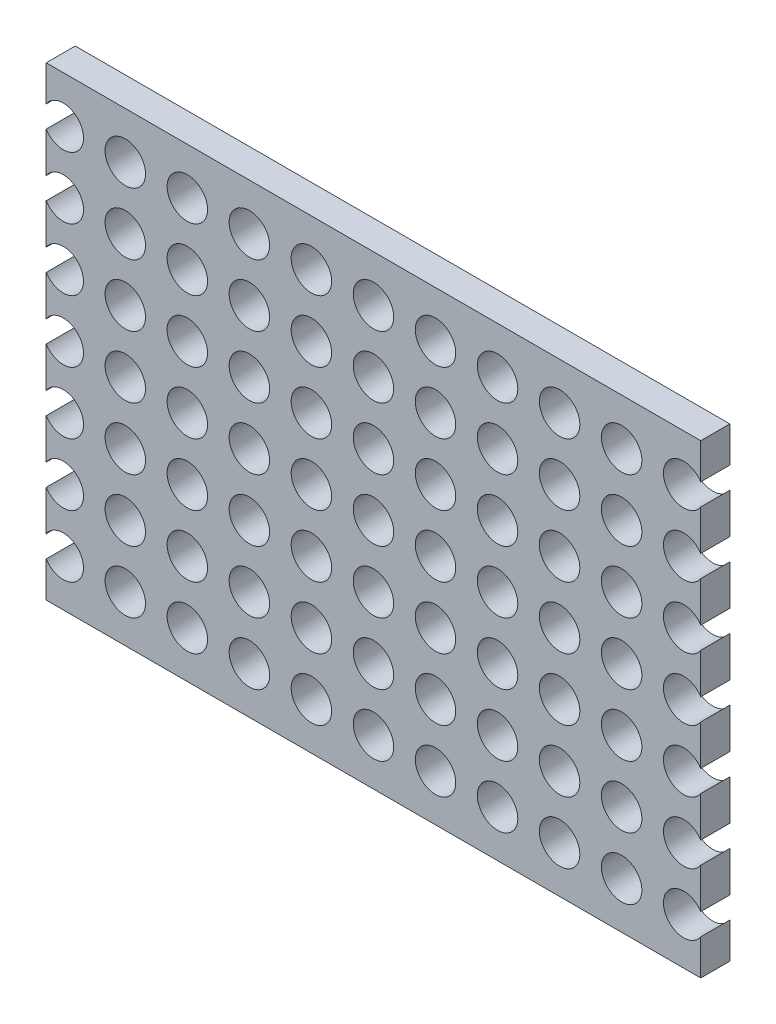
from build123d import *

# Parameters (mm, degrees)
SKETCH1_W           = 107.188
SKETCH1_H           = 76.2
EXTRUDE1_DEPTH      = 4.7625
LPATTERN1_COUNT     = 6
LPATTERN1_PITCH     = 10.16
LPATTERN1_COL_COUNT = 6
LPATTERN1_COL_PITCH = 10.16
LPATTERN2_COUNT     = 4
LPATTERN2_PITCH     = 10.16
LPATTERN2_COL_COUNT = 4
LPATTERN2_COL_PITCH = 10.16


with BuildPart() as part:
    # Sketch1 → Extrude1 (new body)
    with BuildSketch(Plane.XY):
        Rectangle(SKETCH1_W, SKETCH1_H)
    extrude(amount=EXTRUDE1_DEPTH)

    # Sketch5 → G (0.261) Diameter Hole1 (revolve, cut)
    with BuildSketch(Plane(origin=(0, 0, 4.7625), x_dir=(0, -1, 0), z_dir=(1, 0, 0))):
        Polygon((0, 0), (0, 17.231672694), (3.3147, 15.24), (3.3147, 0), align=None)
    g_0_261_diameter_hole1 = revolve(axis=Axis((0, 0, 11.1125), (0, 0, -1)), mode=Mode.SUBTRACT)

    # LPattern1: G (0.261) Diameter Hole1 ×6
    with Locations(*[(i * LPATTERN1_PITCH, 0, 0) for i in range(1, LPATTERN1_COUNT)]):
        add(g_0_261_diameter_hole1, mode=Mode.SUBTRACT)

    # LPattern1 col: G (0.261) Diameter Hole1 ×6
    with Locations(*[(-i * LPATTERN1_COL_PITCH, 0, 0) for i in range(1, LPATTERN1_COL_COUNT)]):
        add(g_0_261_diameter_hole1, mode=Mode.SUBTRACT)

    # LPattern2: G (0.261) Diameter Hole1 ×4
    with Locations(*[(0, -i * LPATTERN2_PITCH, 0) for i in range(1, LPATTERN2_COUNT)]):
        add(g_0_261_diameter_hole1, mode=Mode.SUBTRACT)

    # LPattern2 copy 1 sketch → LPattern2 copy 1 (revolve, cut)
    with BuildSketch(Plane(origin=(10.16, -10.16, 4.7625), x_dir=(0, -1, 0), z_dir=(1, 0, 0))):
        Polygon((0, 0), (0, 17.231672694), (3.3147, 15.24), (3.3147, 0), align=None)
    revolve(axis=Axis((10.16, -10.16, 11.1125), (0, 0, -1)), mode=Mode.SUBTRACT)

    # LPattern2 copy 2 sketch → LPattern2 copy 2 (revolve, cut)
    with BuildSketch(Plane(origin=(10.16, -20.32, 4.7625), x_dir=(0, -1, 0), z_dir=(1, 0, 0))):
        Polygon((0, 0), (0, 17.231672694), (3.3147, 15.24), (3.3147, 0), align=None)
    revolve(axis=Axis((10.16, -20.32, 11.1125), (0, 0, -1)), mode=Mode.SUBTRACT)

    # LPattern2 copy 3 sketch → LPattern2 copy 3 (revolve, cut)
    with BuildSketch(Plane(origin=(10.16, -30.48, 4.7625), x_dir=(0, -1, 0), z_dir=(1, 0, 0))):
        Polygon((0, 0), (0, 17.231672694), (3.3147, 15.24), (3.3147, 0), align=None)
    revolve(axis=Axis((10.16, -30.48, 11.1125), (0, 0, -1)), mode=Mode.SUBTRACT)

    # LPattern2 copy 4 sketch → LPattern2 copy 4 (revolve, cut)
    with BuildSketch(Plane(origin=(20.32, -10.16, 4.7625), x_dir=(0, -1, 0), z_dir=(1, 0, 0))):
        Polygon((0, 0), (0, 17.231672694), (3.3147, 15.24), (3.3147, 0), align=None)
    revolve(axis=Axis((20.32, -10.16, 11.1125), (0, 0, -1)), mode=Mode.SUBTRACT)

    # LPattern2 copy 5 sketch → LPattern2 copy 5 (revolve, cut)
    with BuildSketch(Plane(origin=(20.32, -20.32, 4.7625), x_dir=(0, -1, 0), z_dir=(1, 0, 0))):
        Polygon((0, 0), (0, 17.231672694), (3.3147, 15.24), (3.3147, 0), align=None)
    revolve(axis=Axis((20.32, -20.32, 11.1125), (0, 0, -1)), mode=Mode.SUBTRACT)

    # LPattern2 copy 6 sketch → LPattern2 copy 6 (revolve, cut)
    with BuildSketch(Plane(origin=(20.32, -30.48, 4.7625), x_dir=(0, -1, 0), z_dir=(1, 0, 0))):
        Polygon((0, 0), (0, 17.231672694), (3.3147, 15.24), (3.3147, 0), align=None)
    revolve(axis=Axis((20.32, -30.48, 11.1125), (0, 0, -1)), mode=Mode.SUBTRACT)

    # LPattern2 copy 7 sketch → LPattern2 copy 7 (revolve, cut)
    with BuildSketch(Plane(origin=(30.48, -10.16, 4.7625), x_dir=(0, -1, 0), z_dir=(1, 0, 0))):
        Polygon((0, 0), (0, 17.231672694), (3.3147, 15.24), (3.3147, 0), align=None)
    revolve(axis=Axis((30.48, -10.16, 11.1125), (0, 0, -1)), mode=Mode.SUBTRACT)

    # LPattern2 copy 8 sketch → LPattern2 copy 8 (revolve, cut)
    with BuildSketch(Plane(origin=(30.48, -20.32, 4.7625), x_dir=(0, -1, 0), z_dir=(1, 0, 0))):
        Polygon((0, 0), (0, 17.231672694), (3.3147, 15.24), (3.3147, 0), align=None)
    revolve(axis=Axis((30.48, -20.32, 11.1125), (0, 0, -1)), mode=Mode.SUBTRACT)

    # LPattern2 copy 9 sketch → LPattern2 copy 9 (revolve, cut)
    with BuildSketch(Plane(origin=(30.48, -30.48, 4.7625), x_dir=(0, -1, 0), z_dir=(1, 0, 0))):
        Polygon((0, 0), (0, 17.231672694), (3.3147, 15.24), (3.3147, 0), align=None)
    revolve(axis=Axis((30.48, -30.48, 11.1125), (0, 0, -1)), mode=Mode.SUBTRACT)

    # LPattern2 copy 10 sketch → LPattern2 copy 10 (revolve, cut)
    with BuildSketch(Plane(origin=(40.64, -10.16, 4.7625), x_dir=(0, -1, 0), z_dir=(1, 0, 0))):
        Polygon((0, 0), (0, 17.231672694), (3.3147, 15.24), (3.3147, 0), align=None)
    revolve(axis=Axis((40.64, -10.16, 11.1125), (0, 0, -1)), mode=Mode.SUBTRACT)

    # LPattern2 copy 11 sketch → LPattern2 copy 11 (revolve, cut)
    with BuildSketch(Plane(origin=(40.64, -20.32, 4.7625), x_dir=(0, -1, 0), z_dir=(1, 0, 0))):
        Polygon((0, 0), (0, 17.231672694), (3.3147, 15.24), (3.3147, 0), align=None)
    revolve(axis=Axis((40.64, -20.32, 11.1125), (0, 0, -1)), mode=Mode.SUBTRACT)

    # LPattern2 copy 12 sketch → LPattern2 copy 12 (revolve, cut)
    with BuildSketch(Plane(origin=(40.64, -30.48, 4.7625), x_dir=(0, -1, 0), z_dir=(1, 0, 0))):
        Polygon((0, 0), (0, 17.231672694), (3.3147, 15.24), (3.3147, 0), align=None)
    revolve(axis=Axis((40.64, -30.48, 11.1125), (0, 0, -1)), mode=Mode.SUBTRACT)

    # LPattern2 copy 13 sketch → LPattern2 copy 13 (revolve, cut)
    with BuildSketch(Plane(origin=(50.8, -10.16, 4.7625), x_dir=(0, -1, 0), z_dir=(1, 0, 0))):
        Polygon((0, 0), (0, 17.231672694), (3.3147, 15.24), (3.3147, 0), align=None)
    revolve(axis=Axis((50.8, -10.16, 11.1125), (0, 0, -1)), mode=Mode.SUBTRACT)

    # LPattern2 copy 14 sketch → LPattern2 copy 14 (revolve, cut)
    with BuildSketch(Plane(origin=(50.8, -20.32, 4.7625), x_dir=(0, -1, 0), z_dir=(1, 0, 0))):
        Polygon((0, 0), (0, 17.231672694), (3.3147, 15.24), (3.3147, 0), align=None)
    revolve(axis=Axis((50.8, -20.32, 11.1125), (0, 0, -1)), mode=Mode.SUBTRACT)

    # LPattern2 copy 15 sketch → LPattern2 copy 15 (revolve, cut)
    with BuildSketch(Plane(origin=(50.8, -30.48, 4.7625), x_dir=(0, -1, 0), z_dir=(1, 0, 0))):
        Polygon((0, 0), (0, 17.231672694), (3.3147, 15.24), (3.3147, 0), align=None)
    revolve(axis=Axis((50.8, -30.48, 11.1125), (0, 0, -1)), mode=Mode.SUBTRACT)

    # LPattern2 copy 16 sketch → LPattern2 copy 16 (revolve, cut)
    with BuildSketch(Plane(origin=(-10.16, -10.16, 4.7625), x_dir=(0, -1, 0), z_dir=(1, 0, 0))):
        Polygon((0, 0), (0, 17.231672694), (3.3147, 15.24), (3.3147, 0), align=None)
    revolve(axis=Axis((-10.16, -10.16, 11.1125), (0, 0, -1)), mode=Mode.SUBTRACT)

    # LPattern2 copy 17 sketch → LPattern2 copy 17 (revolve, cut)
    with BuildSketch(Plane(origin=(-10.16, -20.32, 4.7625), x_dir=(0, -1, 0), z_dir=(1, 0, 0))):
        Polygon((0, 0), (0, 17.231672694), (3.3147, 15.24), (3.3147, 0), align=None)
    revolve(axis=Axis((-10.16, -20.32, 11.1125), (0, 0, -1)), mode=Mode.SUBTRACT)

    # LPattern2 copy 18 sketch → LPattern2 copy 18 (revolve, cut)
    with BuildSketch(Plane(origin=(-10.16, -30.48, 4.7625), x_dir=(0, -1, 0), z_dir=(1, 0, 0))):
        Polygon((0, 0), (0, 17.231672694), (3.3147, 15.24), (3.3147, 0), align=None)
    revolve(axis=Axis((-10.16, -30.48, 11.1125), (0, 0, -1)), mode=Mode.SUBTRACT)

    # LPattern2 copy 19 sketch → LPattern2 copy 19 (revolve, cut)
    with BuildSketch(Plane(origin=(-20.32, -10.16, 4.7625), x_dir=(0, -1, 0), z_dir=(1, 0, 0))):
        Polygon((0, 0), (0, 17.231672694), (3.3147, 15.24), (3.3147, 0), align=None)
    revolve(axis=Axis((-20.32, -10.16, 11.1125), (0, 0, -1)), mode=Mode.SUBTRACT)

    # LPattern2 copy 20 sketch → LPattern2 copy 20 (revolve, cut)
    with BuildSketch(Plane(origin=(-20.32, -20.32, 4.7625), x_dir=(0, -1, 0), z_dir=(1, 0, 0))):
        Polygon((0, 0), (0, 17.231672694), (3.3147, 15.24), (3.3147, 0), align=None)
    revolve(axis=Axis((-20.32, -20.32, 11.1125), (0, 0, -1)), mode=Mode.SUBTRACT)

    # LPattern2 copy 21 sketch → LPattern2 copy 21 (revolve, cut)
    with BuildSketch(Plane(origin=(-20.32, -30.48, 4.7625), x_dir=(0, -1, 0), z_dir=(1, 0, 0))):
        Polygon((0, 0), (0, 17.231672694), (3.3147, 15.24), (3.3147, 0), align=None)
    revolve(axis=Axis((-20.32, -30.48, 11.1125), (0, 0, -1)), mode=Mode.SUBTRACT)

    # LPattern2 copy 22 sketch → LPattern2 copy 22 (revolve, cut)
    with BuildSketch(Plane(origin=(-30.48, -10.16, 4.7625), x_dir=(0, -1, 0), z_dir=(1, 0, 0))):
        Polygon((0, 0), (0, 17.231672694), (3.3147, 15.24), (3.3147, 0), align=None)
    revolve(axis=Axis((-30.48, -10.16, 11.1125), (0, 0, -1)), mode=Mode.SUBTRACT)

    # LPattern2 copy 23 sketch → LPattern2 copy 23 (revolve, cut)
    with BuildSketch(Plane(origin=(-30.48, -20.32, 4.7625), x_dir=(0, -1, 0), z_dir=(1, 0, 0))):
        Polygon((0, 0), (0, 17.231672694), (3.3147, 15.24), (3.3147, 0), align=None)
    revolve(axis=Axis((-30.48, -20.32, 11.1125), (0, 0, -1)), mode=Mode.SUBTRACT)

    # LPattern2 copy 24 sketch → LPattern2 copy 24 (revolve, cut)
    with BuildSketch(Plane(origin=(-30.48, -30.48, 4.7625), x_dir=(0, -1, 0), z_dir=(1, 0, 0))):
        Polygon((0, 0), (0, 17.231672694), (3.3147, 15.24), (3.3147, 0), align=None)
    revolve(axis=Axis((-30.48, -30.48, 11.1125), (0, 0, -1)), mode=Mode.SUBTRACT)

    # LPattern2 copy 25 sketch → LPattern2 copy 25 (revolve, cut)
    with BuildSketch(Plane(origin=(-40.64, -10.16, 4.7625), x_dir=(0, -1, 0), z_dir=(1, 0, 0))):
        Polygon((0, 0), (0, 17.231672694), (3.3147, 15.24), (3.3147, 0), align=None)
    revolve(axis=Axis((-40.64, -10.16, 11.1125), (0, 0, -1)), mode=Mode.SUBTRACT)

    # LPattern2 copy 26 sketch → LPattern2 copy 26 (revolve, cut)
    with BuildSketch(Plane(origin=(-40.64, -20.32, 4.7625), x_dir=(0, -1, 0), z_dir=(1, 0, 0))):
        Polygon((0, 0), (0, 17.231672694), (3.3147, 15.24), (3.3147, 0), align=None)
    revolve(axis=Axis((-40.64, -20.32, 11.1125), (0, 0, -1)), mode=Mode.SUBTRACT)

    # LPattern2 copy 27 sketch → LPattern2 copy 27 (revolve, cut)
    with BuildSketch(Plane(origin=(-40.64, -30.48, 4.7625), x_dir=(0, -1, 0), z_dir=(1, 0, 0))):
        Polygon((0, 0), (0, 17.231672694), (3.3147, 15.24), (3.3147, 0), align=None)
    revolve(axis=Axis((-40.64, -30.48, 11.1125), (0, 0, -1)), mode=Mode.SUBTRACT)

    # LPattern2 copy 28 sketch → LPattern2 copy 28 (revolve, cut)
    with BuildSketch(Plane(origin=(-50.8, -10.16, 4.7625), x_dir=(0, -1, 0), z_dir=(1, 0, 0))):
        Polygon((0, 0), (0, 17.231672694), (3.3147, 15.24), (3.3147, 0), align=None)
    revolve(axis=Axis((-50.8, -10.16, 11.1125), (0, 0, -1)), mode=Mode.SUBTRACT)

    # LPattern2 copy 29 sketch → LPattern2 copy 29 (revolve, cut)
    with BuildSketch(Plane(origin=(-50.8, -20.32, 4.7625), x_dir=(0, -1, 0), z_dir=(1, 0, 0))):
        Polygon((0, 0), (0, 17.231672694), (3.3147, 15.24), (3.3147, 0), align=None)
    revolve(axis=Axis((-50.8, -20.32, 11.1125), (0, 0, -1)), mode=Mode.SUBTRACT)

    # LPattern2 copy 30 sketch → LPattern2 copy 30 (revolve, cut)
    with BuildSketch(Plane(origin=(-50.8, -30.48, 4.7625), x_dir=(0, -1, 0), z_dir=(1, 0, 0))):
        Polygon((0, 0), (0, 17.231672694), (3.3147, 15.24), (3.3147, 0), align=None)
    revolve(axis=Axis((-50.8, -30.48, 11.1125), (0, 0, -1)), mode=Mode.SUBTRACT)

    # LPattern2 col: G (0.261) Diameter Hole1 ×4
    with Locations(*[(0, i * LPATTERN2_COL_PITCH, 0) for i in range(1, LPATTERN2_COL_COUNT)]):
        add(g_0_261_diameter_hole1, mode=Mode.SUBTRACT)

    # LPattern2 col copy 1 sketch → LPattern2 col copy 1 (revolve, cut)
    with BuildSketch(Plane(origin=(10.16, 10.16, 4.7625), x_dir=(0, -1, 0), z_dir=(1, 0, 0))):
        Polygon((0, 0), (0, 17.231672694), (3.3147, 15.24), (3.3147, 0), align=None)
    revolve(axis=Axis((10.16, 10.16, 11.1125), (0, 0, -1)), mode=Mode.SUBTRACT)

    # LPattern2 col copy 2 sketch → LPattern2 col copy 2 (revolve, cut)
    with BuildSketch(Plane(origin=(10.16, 20.32, 4.7625), x_dir=(0, -1, 0), z_dir=(1, 0, 0))):
        Polygon((0, 0), (0, 17.231672694), (3.3147, 15.24), (3.3147, 0), align=None)
    revolve(axis=Axis((10.16, 20.32, 11.1125), (0, 0, -1)), mode=Mode.SUBTRACT)

    # LPattern2 col copy 3 sketch → LPattern2 col copy 3 (revolve, cut)
    with BuildSketch(Plane(origin=(10.16, 30.48, 4.7625), x_dir=(0, -1, 0), z_dir=(1, 0, 0))):
        Polygon((0, 0), (0, 17.231672694), (3.3147, 15.24), (3.3147, 0), align=None)
    revolve(axis=Axis((10.16, 30.48, 11.1125), (0, 0, -1)), mode=Mode.SUBTRACT)

    # LPattern2 col copy 4 sketch → LPattern2 col copy 4 (revolve, cut)
    with BuildSketch(Plane(origin=(20.32, 10.16, 4.7625), x_dir=(0, -1, 0), z_dir=(1, 0, 0))):
        Polygon((0, 0), (0, 17.231672694), (3.3147, 15.24), (3.3147, 0), align=None)
    revolve(axis=Axis((20.32, 10.16, 11.1125), (0, 0, -1)), mode=Mode.SUBTRACT)

    # LPattern2 col copy 5 sketch → LPattern2 col copy 5 (revolve, cut)
    with BuildSketch(Plane(origin=(20.32, 20.32, 4.7625), x_dir=(0, -1, 0), z_dir=(1, 0, 0))):
        Polygon((0, 0), (0, 17.231672694), (3.3147, 15.24), (3.3147, 0), align=None)
    revolve(axis=Axis((20.32, 20.32, 11.1125), (0, 0, -1)), mode=Mode.SUBTRACT)

    # LPattern2 col copy 6 sketch → LPattern2 col copy 6 (revolve, cut)
    with BuildSketch(Plane(origin=(20.32, 30.48, 4.7625), x_dir=(0, -1, 0), z_dir=(1, 0, 0))):
        Polygon((0, 0), (0, 17.231672694), (3.3147, 15.24), (3.3147, 0), align=None)
    revolve(axis=Axis((20.32, 30.48, 11.1125), (0, 0, -1)), mode=Mode.SUBTRACT)

    # LPattern2 col copy 7 sketch → LPattern2 col copy 7 (revolve, cut)
    with BuildSketch(Plane(origin=(30.48, 10.16, 4.7625), x_dir=(0, -1, 0), z_dir=(1, 0, 0))):
        Polygon((0, 0), (0, 17.231672694), (3.3147, 15.24), (3.3147, 0), align=None)
    revolve(axis=Axis((30.48, 10.16, 11.1125), (0, 0, -1)), mode=Mode.SUBTRACT)

    # LPattern2 col copy 8 sketch → LPattern2 col copy 8 (revolve, cut)
    with BuildSketch(Plane(origin=(30.48, 20.32, 4.7625), x_dir=(0, -1, 0), z_dir=(1, 0, 0))):
        Polygon((0, 0), (0, 17.231672694), (3.3147, 15.24), (3.3147, 0), align=None)
    revolve(axis=Axis((30.48, 20.32, 11.1125), (0, 0, -1)), mode=Mode.SUBTRACT)

    # LPattern2 col copy 9 sketch → LPattern2 col copy 9 (revolve, cut)
    with BuildSketch(Plane(origin=(30.48, 30.48, 4.7625), x_dir=(0, -1, 0), z_dir=(1, 0, 0))):
        Polygon((0, 0), (0, 17.231672694), (3.3147, 15.24), (3.3147, 0), align=None)
    revolve(axis=Axis((30.48, 30.48, 11.1125), (0, 0, -1)), mode=Mode.SUBTRACT)

    # LPattern2 col copy 10 sketch → LPattern2 col copy 10 (revolve, cut)
    with BuildSketch(Plane(origin=(40.64, 10.16, 4.7625), x_dir=(0, -1, 0), z_dir=(1, 0, 0))):
        Polygon((0, 0), (0, 17.231672694), (3.3147, 15.24), (3.3147, 0), align=None)
    revolve(axis=Axis((40.64, 10.16, 11.1125), (0, 0, -1)), mode=Mode.SUBTRACT)

    # LPattern2 col copy 11 sketch → LPattern2 col copy 11 (revolve, cut)
    with BuildSketch(Plane(origin=(40.64, 20.32, 4.7625), x_dir=(0, -1, 0), z_dir=(1, 0, 0))):
        Polygon((0, 0), (0, 17.231672694), (3.3147, 15.24), (3.3147, 0), align=None)
    revolve(axis=Axis((40.64, 20.32, 11.1125), (0, 0, -1)), mode=Mode.SUBTRACT)

    # LPattern2 col copy 12 sketch → LPattern2 col copy 12 (revolve, cut)
    with BuildSketch(Plane(origin=(40.64, 30.48, 4.7625), x_dir=(0, -1, 0), z_dir=(1, 0, 0))):
        Polygon((0, 0), (0, 17.231672694), (3.3147, 15.24), (3.3147, 0), align=None)
    revolve(axis=Axis((40.64, 30.48, 11.1125), (0, 0, -1)), mode=Mode.SUBTRACT)

    # LPattern2 col copy 13 sketch → LPattern2 col copy 13 (revolve, cut)
    with BuildSketch(Plane(origin=(50.8, 10.16, 4.7625), x_dir=(0, -1, 0), z_dir=(1, 0, 0))):
        Polygon((0, 0), (0, 17.231672694), (3.3147, 15.24), (3.3147, 0), align=None)
    revolve(axis=Axis((50.8, 10.16, 11.1125), (0, 0, -1)), mode=Mode.SUBTRACT)

    # LPattern2 col copy 14 sketch → LPattern2 col copy 14 (revolve, cut)
    with BuildSketch(Plane(origin=(50.8, 20.32, 4.7625), x_dir=(0, -1, 0), z_dir=(1, 0, 0))):
        Polygon((0, 0), (0, 17.231672694), (3.3147, 15.24), (3.3147, 0), align=None)
    revolve(axis=Axis((50.8, 20.32, 11.1125), (0, 0, -1)), mode=Mode.SUBTRACT)

    # LPattern2 col copy 15 sketch → LPattern2 col copy 15 (revolve, cut)
    with BuildSketch(Plane(origin=(50.8, 30.48, 4.7625), x_dir=(0, -1, 0), z_dir=(1, 0, 0))):
        Polygon((0, 0), (0, 17.231672694), (3.3147, 15.24), (3.3147, 0), align=None)
    revolve(axis=Axis((50.8, 30.48, 11.1125), (0, 0, -1)), mode=Mode.SUBTRACT)

    # LPattern2 col copy 16 sketch → LPattern2 col copy 16 (revolve, cut)
    with BuildSketch(Plane(origin=(-10.16, 10.16, 4.7625), x_dir=(0, -1, 0), z_dir=(1, 0, 0))):
        Polygon((0, 0), (0, 17.231672694), (3.3147, 15.24), (3.3147, 0), align=None)
    revolve(axis=Axis((-10.16, 10.16, 11.1125), (0, 0, -1)), mode=Mode.SUBTRACT)

    # LPattern2 col copy 17 sketch → LPattern2 col copy 17 (revolve, cut)
    with BuildSketch(Plane(origin=(-10.16, 20.32, 4.7625), x_dir=(0, -1, 0), z_dir=(1, 0, 0))):
        Polygon((0, 0), (0, 17.231672694), (3.3147, 15.24), (3.3147, 0), align=None)
    revolve(axis=Axis((-10.16, 20.32, 11.1125), (0, 0, -1)), mode=Mode.SUBTRACT)

    # LPattern2 col copy 18 sketch → LPattern2 col copy 18 (revolve, cut)
    with BuildSketch(Plane(origin=(-10.16, 30.48, 4.7625), x_dir=(0, -1, 0), z_dir=(1, 0, 0))):
        Polygon((0, 0), (0, 17.231672694), (3.3147, 15.24), (3.3147, 0), align=None)
    revolve(axis=Axis((-10.16, 30.48, 11.1125), (0, 0, -1)), mode=Mode.SUBTRACT)

    # LPattern2 col copy 19 sketch → LPattern2 col copy 19 (revolve, cut)
    with BuildSketch(Plane(origin=(-20.32, 10.16, 4.7625), x_dir=(0, -1, 0), z_dir=(1, 0, 0))):
        Polygon((0, 0), (0, 17.231672694), (3.3147, 15.24), (3.3147, 0), align=None)
    revolve(axis=Axis((-20.32, 10.16, 11.1125), (0, 0, -1)), mode=Mode.SUBTRACT)

    # LPattern2 col copy 20 sketch → LPattern2 col copy 20 (revolve, cut)
    with BuildSketch(Plane(origin=(-20.32, 20.32, 4.7625), x_dir=(0, -1, 0), z_dir=(1, 0, 0))):
        Polygon((0, 0), (0, 17.231672694), (3.3147, 15.24), (3.3147, 0), align=None)
    revolve(axis=Axis((-20.32, 20.32, 11.1125), (0, 0, -1)), mode=Mode.SUBTRACT)

    # LPattern2 col copy 21 sketch → LPattern2 col copy 21 (revolve, cut)
    with BuildSketch(Plane(origin=(-20.32, 30.48, 4.7625), x_dir=(0, -1, 0), z_dir=(1, 0, 0))):
        Polygon((0, 0), (0, 17.231672694), (3.3147, 15.24), (3.3147, 0), align=None)
    revolve(axis=Axis((-20.32, 30.48, 11.1125), (0, 0, -1)), mode=Mode.SUBTRACT)

    # LPattern2 col copy 22 sketch → LPattern2 col copy 22 (revolve, cut)
    with BuildSketch(Plane(origin=(-30.48, 10.16, 4.7625), x_dir=(0, -1, 0), z_dir=(1, 0, 0))):
        Polygon((0, 0), (0, 17.231672694), (3.3147, 15.24), (3.3147, 0), align=None)
    revolve(axis=Axis((-30.48, 10.16, 11.1125), (0, 0, -1)), mode=Mode.SUBTRACT)

    # LPattern2 col copy 23 sketch → LPattern2 col copy 23 (revolve, cut)
    with BuildSketch(Plane(origin=(-30.48, 20.32, 4.7625), x_dir=(0, -1, 0), z_dir=(1, 0, 0))):
        Polygon((0, 0), (0, 17.231672694), (3.3147, 15.24), (3.3147, 0), align=None)
    revolve(axis=Axis((-30.48, 20.32, 11.1125), (0, 0, -1)), mode=Mode.SUBTRACT)

    # LPattern2 col copy 24 sketch → LPattern2 col copy 24 (revolve, cut)
    with BuildSketch(Plane(origin=(-30.48, 30.48, 4.7625), x_dir=(0, -1, 0), z_dir=(1, 0, 0))):
        Polygon((0, 0), (0, 17.231672694), (3.3147, 15.24), (3.3147, 0), align=None)
    revolve(axis=Axis((-30.48, 30.48, 11.1125), (0, 0, -1)), mode=Mode.SUBTRACT)

    # LPattern2 col copy 25 sketch → LPattern2 col copy 25 (revolve, cut)
    with BuildSketch(Plane(origin=(-40.64, 10.16, 4.7625), x_dir=(0, -1, 0), z_dir=(1, 0, 0))):
        Polygon((0, 0), (0, 17.231672694), (3.3147, 15.24), (3.3147, 0), align=None)
    revolve(axis=Axis((-40.64, 10.16, 11.1125), (0, 0, -1)), mode=Mode.SUBTRACT)

    # LPattern2 col copy 26 sketch → LPattern2 col copy 26 (revolve, cut)
    with BuildSketch(Plane(origin=(-40.64, 20.32, 4.7625), x_dir=(0, -1, 0), z_dir=(1, 0, 0))):
        Polygon((0, 0), (0, 17.231672694), (3.3147, 15.24), (3.3147, 0), align=None)
    revolve(axis=Axis((-40.64, 20.32, 11.1125), (0, 0, -1)), mode=Mode.SUBTRACT)

    # LPattern2 col copy 27 sketch → LPattern2 col copy 27 (revolve, cut)
    with BuildSketch(Plane(origin=(-40.64, 30.48, 4.7625), x_dir=(0, -1, 0), z_dir=(1, 0, 0))):
        Polygon((0, 0), (0, 17.231672694), (3.3147, 15.24), (3.3147, 0), align=None)
    revolve(axis=Axis((-40.64, 30.48, 11.1125), (0, 0, -1)), mode=Mode.SUBTRACT)

    # LPattern2 col copy 28 sketch → LPattern2 col copy 28 (revolve, cut)
    with BuildSketch(Plane(origin=(-50.8, 10.16, 4.7625), x_dir=(0, -1, 0), z_dir=(1, 0, 0))):
        Polygon((0, 0), (0, 17.231672694), (3.3147, 15.24), (3.3147, 0), align=None)
    revolve(axis=Axis((-50.8, 10.16, 11.1125), (0, 0, -1)), mode=Mode.SUBTRACT)

    # LPattern2 col copy 29 sketch → LPattern2 col copy 29 (revolve, cut)
    with BuildSketch(Plane(origin=(-50.8, 20.32, 4.7625), x_dir=(0, -1, 0), z_dir=(1, 0, 0))):
        Polygon((0, 0), (0, 17.231672694), (3.3147, 15.24), (3.3147, 0), align=None)
    revolve(axis=Axis((-50.8, 20.32, 11.1125), (0, 0, -1)), mode=Mode.SUBTRACT)

    # LPattern2 col copy 30 sketch → LPattern2 col copy 30 (revolve, cut)
    with BuildSketch(Plane(origin=(-50.8, 30.48, 4.7625), x_dir=(0, -1, 0), z_dir=(1, 0, 0))):
        Polygon((0, 0), (0, 17.231672694), (3.3147, 15.24), (3.3147, 0), align=None)
    revolve(axis=Axis((-50.8, 30.48, 11.1125), (0, 0, -1)), mode=Mode.SUBTRACT)


solid = part.part
